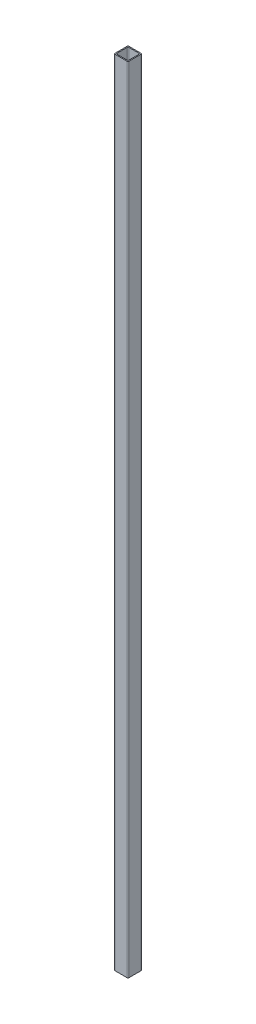
from build123d import *

# Parameters (mm, degrees)
CUSTOM_TUBE_CARRE_35_2_5_1_DEPTH = 2000


with BuildPart() as part:
    # Esquisse11 → Custom TUBE-CARRE-35-2.5(1) (new body)
    with BuildSketch(Plane.ZX):
        with BuildLine():
            Line((-15.5, -17.5), (15.5, -17.5))
            ThreePointArc((15.5, -17.5), (16.914213562, -16.914213562), (17.5, -15.5))
            Line((17.5, -15.5), (17.5, 15.5))
            ThreePointArc((17.5, 15.5), (16.914213562, 16.914213562), (15.5, 17.5))
            Line((15.5, 17.5), (-15.5, 17.5))
            ThreePointArc((-15.5, 17.5), (-16.914213562, 16.914213562), (-17.5, 15.5))
            Line((-17.5, 15.5), (-17.5, -15.5))
            ThreePointArc((-17.5, -15.5), (-16.914213562, -16.914213562), (-15.5, -17.5))
        make_face()
        with BuildLine():
            Line((-13, -15), (13, -15))
            ThreePointArc((13, -15), (14.414213562, -14.414213562), (15, -13))
            Line((15, -13), (15, 13))
            ThreePointArc((15, 13), (14.414213562, 14.414213562), (13, 15))
            Line((13, 15), (-13, 15))
            ThreePointArc((-13, 15), (-14.414213562, 14.414213562), (-15, 13))
            Line((-15, 13), (-15, -13))
            ThreePointArc((-15, -13), (-14.414213562, -14.414213562), (-13, -15))
        make_face(mode=Mode.SUBTRACT)
    extrude(amount=CUSTOM_TUBE_CARRE_35_2_5_1_DEPTH)


solid = part.part
